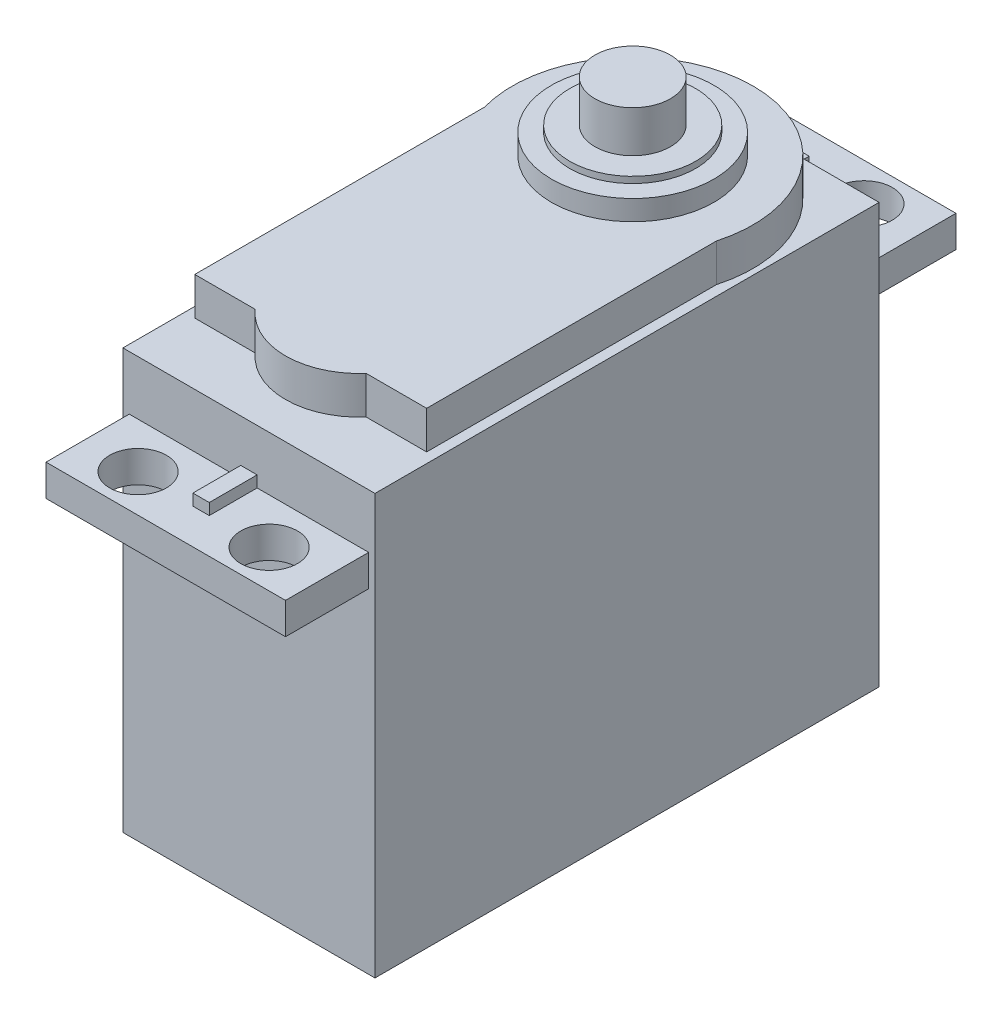
from build123d import *

# Parameters (mm, degrees)
SKETCH1_W                = 20
SKETCH1_H                = 40
BOSS_EXTRUDE1_DEPTH      = 33.3
SKETCH2_W                = 19
SKETCH2_H                = 2.5
BOSS_EXTRUDE2_DEPTH      = 6.6
SKETCH3_W                = 19
SKETCH3_H                = 2.5
BOSS_EXTRUDE3_DEPTH      = 6.6
SKETCH4_R                = 9.55
BOSS_EXTRUDE4_DEPTH      = 3
SKETCH12_W               = 18.4
SKETCH12_H               = 26
BOSS_EXTRUDE10_DEPTH     = 3
SKETCH11_R               = 0.5
BOSS_EXTRUDE9_DEPTH      = 3
LPATTERN2_COUNT          = 3
LPATTERN2_PITCH          = 1.01
SKETCH13_R               = 6.45
BOSS_EXTRUDE11_DEPTH     = 1.6
SKETCH14_R               = 5
BOSS_EXTRUDE12_DEPTH     = 0.5
SKETCH15_R               = 3
BOSS_EXTRUDE13_DEPTH     = 3.3
BOSS_EXTRUDE14_DEPTH     = 3
SKETCH17_W               = 1.3
SKETCH17_H               = 3.8
BOSS_EXTRUDE15_DEPTH     = 0.9
SKETCH18_W               = 1.3
SKETCH18_H               = 3.8
BOSS_EXTRUDE16_DEPTH     = 0.9
M4_CLEARANCE_HOLE1_D     = 4.5
M4_CLEARANCE_HOLE1_DEPTH = 3
M4_CLEARANCE_HOLE1_TIP   = 1.351936393


with BuildPart() as part:
    # Sketch1 → Boss-Extrude1 (new body)
    with BuildSketch(Plane(origin=(0, 0, 0), x_dir=(1, 0, 0), z_dir=(0, 1, 0))):
        with Locations((10, 20)):
            Rectangle(SKETCH1_W, SKETCH1_H)
    extrude(amount=BOSS_EXTRUDE1_DEPTH)

    # Sketch2 → Boss-Extrude2 (add)
    with BuildSketch(Plane.XY):
        with Locations((10, 27.75)):
            Rectangle(SKETCH2_W, SKETCH2_H)
    extrude(amount=BOSS_EXTRUDE2_DEPTH)

    # Sketch3 → Boss-Extrude3 (add)
    with BuildSketch(Plane(origin=(0, 0, -40), x_dir=(-1, 0, 0), z_dir=(0, 0, -1))):
        with Locations((-10, 27.75)):
            Rectangle(SKETCH3_W, SKETCH3_H)
    extrude(amount=BOSS_EXTRUDE3_DEPTH)

    # Sketch4 → Boss-Extrude4 (add)
    with BuildSketch(Plane(origin=(0, 33.3, 0), x_dir=(1, 0, 0), z_dir=(0, 1, 0))):
        with Locations(Location((10, 30.45, 0), (0, 0, 90))):
            Circle(SKETCH4_R)
    extrude(amount=BOSS_EXTRUDE4_DEPTH)

    # Sketch12 → Boss-Extrude10 (add)
    with BuildSketch(Plane(origin=(0, 33.3, 0), x_dir=(1, 0, 0), z_dir=(0, 1, 0))):
        with Locations((10, 17.9)):
            Rectangle(SKETCH12_W, SKETCH12_H)
    extrude(amount=BOSS_EXTRUDE10_DEPTH)

    # Sketch11 → Boss-Extrude9 (add)
    with BuildSketch(Plane(origin=(0, 0, -40), x_dir=(-1, 0, 0), z_dir=(0, 0, -1))):
        with Locations(Location((-11.2, 2.4, 0), (0, 0, 180))):
            Circle(SKETCH11_R)
    boss_extrude9 = extrude(amount=BOSS_EXTRUDE9_DEPTH)

    # LPattern2: Boss-Extrude9 ×3
    with Locations(*[(-i * LPATTERN2_PITCH, 0, 0) for i in range(1, LPATTERN2_COUNT)]):
        add(boss_extrude9)

    # Sketch13 → Boss-Extrude11 (add)
    with BuildSketch(Plane(origin=(0, 36.3, 0), x_dir=(1, 0, 0), z_dir=(0, 1, 0))):
        with Locations(Location((10, 30.45, 0), (0, 0, 270))):
            Circle(SKETCH13_R)
    extrude(amount=BOSS_EXTRUDE11_DEPTH)

    # Sketch14 → Boss-Extrude12 (add)
    with BuildSketch(Plane(origin=(0, 37.9, 0), x_dir=(1, 0, 0), z_dir=(0, 1, 0))):
        with Locations(Location((10, 30.45, 0), (0, 0, 270))):
            Circle(SKETCH14_R)
    extrude(amount=BOSS_EXTRUDE12_DEPTH)

    # Sketch15 → Boss-Extrude13 (add)
    with BuildSketch(Plane(origin=(0, 38.4, 0), x_dir=(1, 0, 0), z_dir=(0, 1, 0))):
        with Locations(Location((10, 30.45, 0), (0, 0, 270))):
            Circle(SKETCH15_R)
    extrude(amount=BOSS_EXTRUDE13_DEPTH)

    # Sketch16 → Boss-Extrude14 (add)
    with BuildSketch(Plane(origin=(0, 33.3, 0), x_dir=(1, 0, 0), z_dir=(0, 1, 0))):
        with BuildLine():
            Line((14.4, 4.9), (5.6, 4.9))
            ThreePointArc((5.6, 4.9), (10, 2.9), (14.4, 4.9))
        make_face()
    extrude(amount=BOSS_EXTRUDE14_DEPTH)

    # Sketch17 → Boss-Extrude15 (add)
    with BuildSketch(Plane(origin=(0, 29, 0), x_dir=(1, 0, 0), z_dir=(0, 1, 0))):
        with Locations((10, -1.9)):
            Rectangle(SKETCH17_W, SKETCH17_H)
    extrude(amount=BOSS_EXTRUDE15_DEPTH)

    # Sketch18 → Boss-Extrude16 (add)
    with BuildSketch(Plane(origin=(0, 29, 0), x_dir=(1, 0, 0), z_dir=(0, 1, 0))):
        with Locations((10, 41.9)):
            Rectangle(SKETCH18_W, SKETCH18_H)
    extrude(amount=BOSS_EXTRUDE16_DEPTH)

    # M4 Clearance Hole1
    with Locations(Plane(origin=(0, 29, 0), x_dir=(1, 0, 0), z_dir=(0, 1, 0))):
        with Locations((4.8, 43.6), (15.2, 43.6), (4.8, -3.6), (15.2, -3.6)):
            Hole(M4_CLEARANCE_HOLE1_D / 2, depth=M4_CLEARANCE_HOLE1_DEPTH)
            with Locations((0, 0, -(M4_CLEARANCE_HOLE1_DEPTH + M4_CLEARANCE_HOLE1_TIP / 2))):  # 118° drill point
                Cone(0, M4_CLEARANCE_HOLE1_D / 2, M4_CLEARANCE_HOLE1_TIP, mode=Mode.SUBTRACT)


solid = part.part
